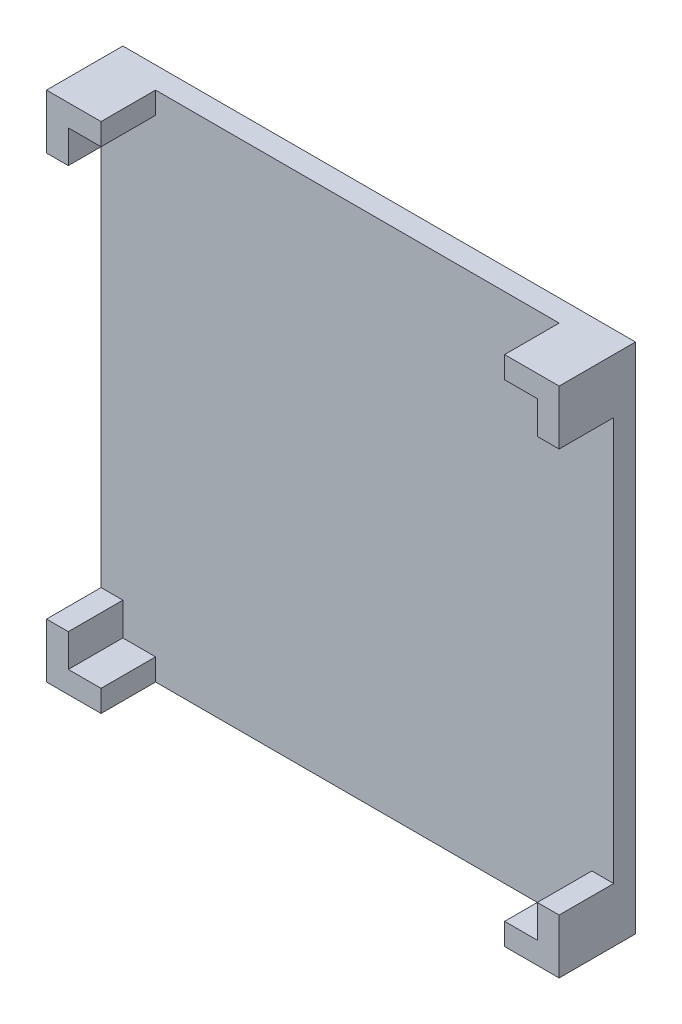
from build123d import *

# Parameters (mm, degrees)
SKETCH1_W           = 47
SKETCH1_H           = 47
BOSS_EXTRUDE1_DEPTH = 2
BOSS_EXTRUDE2_DEPTH = 5


with BuildPart() as part:
    # Sketch1 → Boss-Extrude1 (new body)
    with BuildSketch(Plane.XY):
        with Locations((23.5, 23.5)):
            Rectangle(SKETCH1_W, SKETCH1_H)
    extrude(amount=BOSS_EXTRUDE1_DEPTH)

    # Sketch2 → Boss-Extrude2 (add)
    with BuildSketch(Plane.XY.offset(2)):
        Polygon((5, 47), (5, 45), (2, 45), (2, 42), (0, 42), (0, 47), align=None)
        Polygon((42, 47), (42, 45), (45, 45), (45, 42), (47, 42), (47, 47), align=None)
        Polygon((0, 5), (0, 0), (5, 0), (5, 2), (2, 2), (2, 5), align=None)
        Polygon((47, 5), (45, 5), (45, 2), (42, 2), (42, 0), (47, 0), align=None)
    extrude(amount=BOSS_EXTRUDE2_DEPTH)


solid = part.part
